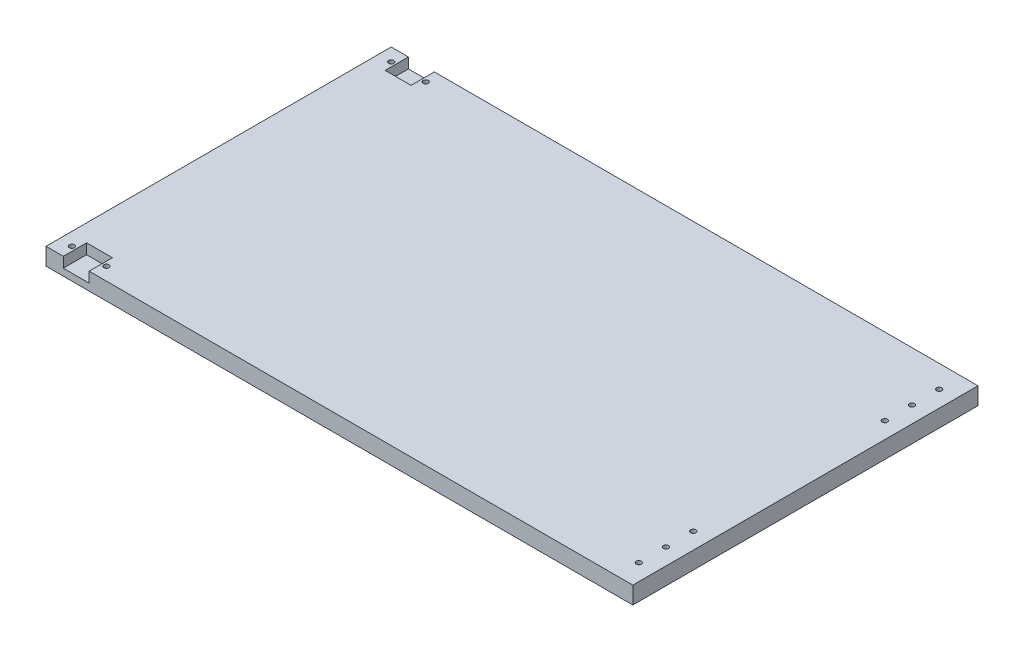
from build123d import *

# Parameters (mm, degrees)
SKETCH1_W           = 680
SKETCH1_H           = 400
BOSS_EXTRUDE1_DEPTH = 20
SKETCH2_W           = 30
SKETCH2_H           = 27
CUT_EXTRUDE1_DEPTH  = 12
SKETCH3_R           = 3
CUT_EXTRUDE2_DEPTH  = 13
SKETCH4_R           = 3
CUT_EXTRUDE3_DEPTH  = 13


with BuildPart() as part:
    # Sketch1 → Boss-Extrude1 (new body)
    with BuildSketch(Plane(origin=(0, 0, 0), x_dir=(1, 0, 0), z_dir=(0, 1, 0))):
        Rectangle(SKETCH1_W, SKETCH1_H)
    extrude(amount=BOSS_EXTRUDE1_DEPTH)

    # Sketch2 → Cut-Extrude1 (cut)
    with BuildSketch(Plane(origin=(0, 20, 0), x_dir=(1, 0, 0), z_dir=(0, 1, 0))):
        with Locations((-305, -186.5)):
            Rectangle(SKETCH2_W, SKETCH2_H)
    cut_extrude1 = extrude(amount=-CUT_EXTRUDE1_DEPTH, mode=Mode.SUBTRACT)

    # Mirror1: Cut-Extrude1 across plane
    add(cut_extrude1.mirror(Plane.XY), mode=Mode.SUBTRACT)

    # Sketch3 → Cut-Extrude2 (cut)
    with BuildSketch(Plane(origin=(0, 20, 0), x_dir=(1, 0, 0), z_dir=(0, 1, 0))):
        with Locations(Location((321, -174, 0), (0, 0, 270))):
            Circle(SKETCH3_R)
        with Locations(Location((321, -142.5, 0), (0, 0, 270))):
            Circle(SKETCH3_R)
        with Locations(Location((321, -111, 0), (0, 0, 270))):
            Circle(SKETCH3_R)
    cut_extrude2 = extrude(amount=-CUT_EXTRUDE2_DEPTH, mode=Mode.SUBTRACT)

    # Mirror2: Cut-Extrude2 across plane
    add(cut_extrude2.mirror(Plane.XY), mode=Mode.SUBTRACT)

    # Sketch4 → Cut-Extrude3 (cut)
    with BuildSketch(Plane(origin=(0, 20, 0), x_dir=(1, 0, 0), z_dir=(0, 1, 0))):
        with Locations(Location((-325, -185, 0), (0, 0, 270))):
            Circle(SKETCH4_R)
        with Locations(Location((-285, -185, 0), (0, 0, 270))):
            Circle(SKETCH4_R)
    cut_extrude3 = extrude(amount=-CUT_EXTRUDE3_DEPTH, mode=Mode.SUBTRACT)

    # Mirror3: Cut-Extrude3 across plane
    add(cut_extrude3.mirror(Plane.XY), mode=Mode.SUBTRACT)


solid = part.part
